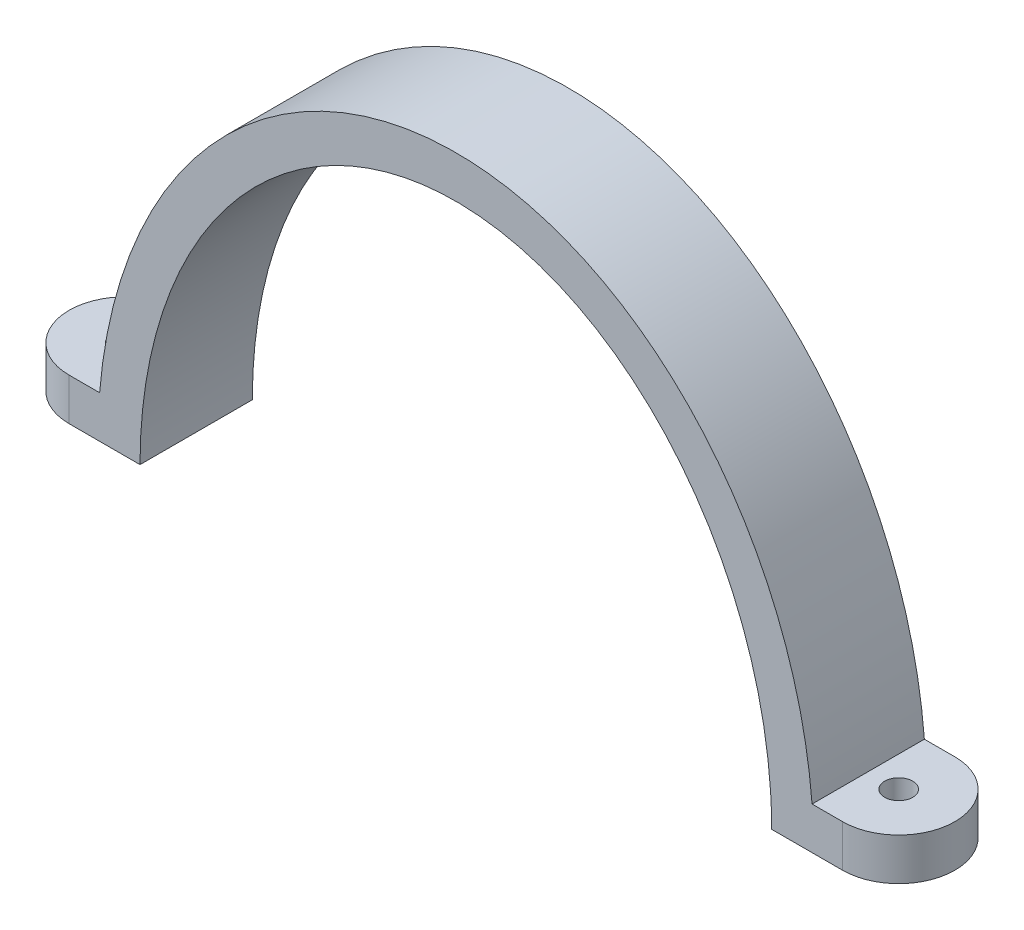
from build123d import *

# Parameters (mm, degrees)
SKETCH1_R             = 1
BOSS_EXTRUDE1_DEPTH   = 3
BOSS_EXTRUDE1_2_DEPTH = 3
BOSS_EXTRUDE2_DEPTH   = 4


with BuildPart() as part:
    # Sketch1 → Boss-Extrude1 (new body)
    with BuildSketch(Plane(origin=(0, 0, 0), x_dir=(1, 0, 0), z_dir=(0, 1, 0))):
        with BuildLine():
            Line((0, -4), (5, -4))
            Line((5, -4), (5, 4))
            Line((5, 4), (0, 4))
            ThreePointArc((0, 4), (-4, 0), (0, -4))
        make_face()
        with Locations(Location((0, 0, 0), (0, 0, 270))):
            Circle(SKETCH1_R, mode=Mode.SUBTRACT)
    extrude(amount=BOSS_EXTRUDE1_DEPTH)



with BuildPart() as body_2:
    # Sketch1 → Boss-Extrude1 2 (new body)
    with BuildSketch(Plane(origin=(0, 0, 0), x_dir=(1, 0, 0), z_dir=(0, 1, 0))):
        with BuildLine():
            Line((55.1, -4), (50.1, -4))
            Line((50.1, -4), (50.1, 4))
            Line((50.1, 4), (55.1, 4))
            ThreePointArc((55.1, 4), (59.1, 0), (55.1, -4))
        make_face()
        with Locations(Location((55.1, 0, 0), (0, 0, 270))):
            Circle(SKETCH1_R, mode=Mode.SUBTRACT)
    extrude(amount=BOSS_EXTRUDE1_2_DEPTH)


with BuildPart() as part_1:
    add(part.part)

    add(body_2.part)  # Boss-Extrude2 merges body 2
    # Sketch2 → Boss-Extrude2 (add, symmetric)
    with BuildSketch(Plane.XY):
        with BuildLine():
            Line((2.05, 0), (5.05, 0))
            add(Edge.make_bspline(
                [(50.05, 0), (50.05, 27.5), (27.55, 27.5), (5.05, 27.5), (5.05, 0)],
                knots=[4.71238898, 4.71238898, 4.71238898, 6.283185307, 6.283185307, 7.853981634, 7.853981634, 7.853981634], degree=2, weights=[1, 0.707106781, 1, 0.707106781, 1]))
            Line((50.05, 0), (53.05, 0))
            add(Edge.make_bspline(
                [(53.05, 0), (53.05, 30.5), (27.55, 30.5), (2.05, 30.5), (2.05, 0)],
                knots=[4.71238898, 4.71238898, 4.71238898, 6.283185307, 6.283185307, 7.853981634, 7.853981634, 7.853981634], degree=2, weights=[1, 0.707106781, 1, 0.707106781, 1]))
        make_face()
    extrude(amount=BOSS_EXTRUDE2_DEPTH, both=True)


solid = part_1.part
